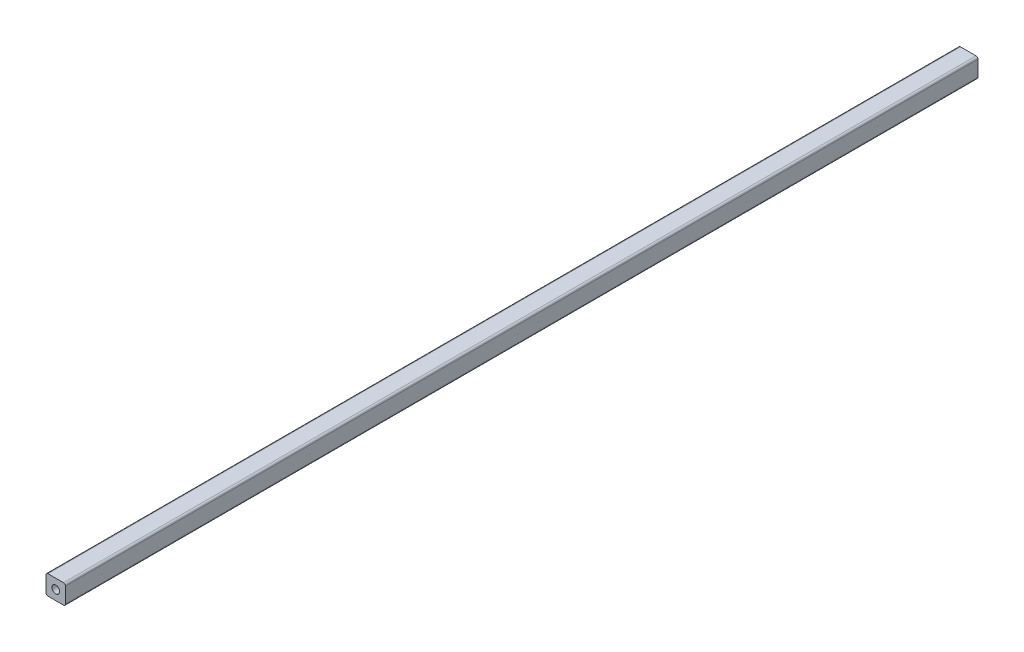
from build123d import *

# Parameters (mm, degrees)
SKETCH1_W           = 50.8
SKETCH1_H           = 50.8
SKETCH1_R           = 10
BOSS_EXTRUDE1_DEPTH = 2381.25
FILLET1_R           = 5


with BuildPart() as part:
    # Sketch1 → Boss-Extrude1 (new body)
    with BuildSketch(Plane.XY):
        Rectangle(SKETCH1_W, SKETCH1_H)
        Circle(SKETCH1_R, mode=Mode.SUBTRACT)
    extrude(amount=BOSS_EXTRUDE1_DEPTH)

    # Fillet1
    fillet1_edges = [part.edges().sort_by_distance(p)[0] for p in [
        (25.4, -25.4, 1190.625),
        (-25.4, -25.4, 1190.625),
        (-25.4, 25.4, 1190.625),
        (25.4, 25.4, 1190.625),
    ]]
    fillet(fillet1_edges, radius=FILLET1_R)


solid = part.part
